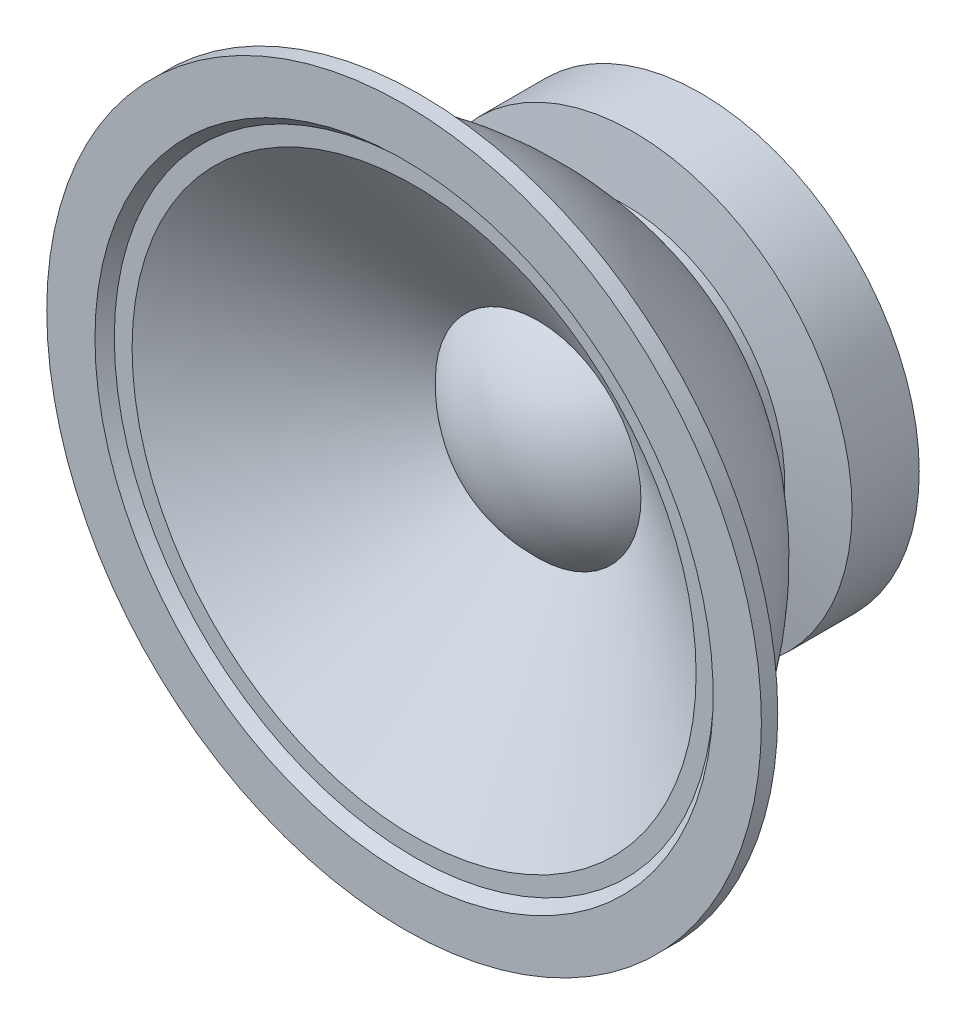
from build123d import *


with BuildPart() as part:
    # Sketch1 → Revolve1 (revolve)
    with BuildSketch(Plane(origin=(0, 0, 0), x_dir=(1, 0, 0), z_dir=(0, 1, 0)), mode=Mode.PRIVATE) as revolve1_sk:
        with BuildLine():
            Line((0, 173.99), (34.441352467, 173.99))
            Line((34.441352467, 173.99), (120.362804335, 163.445094544))
            Line((120.362804335, 163.445094544), (120.362804335, 126.418045415))
            Line((120.362804335, 126.418045415), (87.930206626, 121.717541752))
            Line((87.930206626, 121.717541752), (87.930206626, 116.489255163))
            ThreePointArc((87.930206626, 116.489255163), (140.794360125, 69.808266343), (176.53, 9.007793606))
            Line((176.53, 9.007793606), (196.85, 9.007793606))
            Line((196.85, 9.007793606), (196.85, 0))
            Line((196.85, 0), (170.287454318, 0))
            Line((170.287454318, 0), (165.146134883, 5.519041131))
            Line((165.146134883, 5.519041131), (155.357244635, 5.519041131))
            Line((155.357244635, 5.519041131), (56.635000781, 73.859502497))
            ThreePointArc((56.635000781, 73.859502497), (30.894765948, 55.598294044), (0, 49.152763773))
            Line((0, 49.152763773), (0, 173.99))
        make_face()
    revolve(revolve1_sk.sketch.rotate(Axis((0, 0, -173.99), (0, 0, 1)), 180), axis=Axis((0, 0, -173.99), (0, 0, 1)))


solid = part.part
